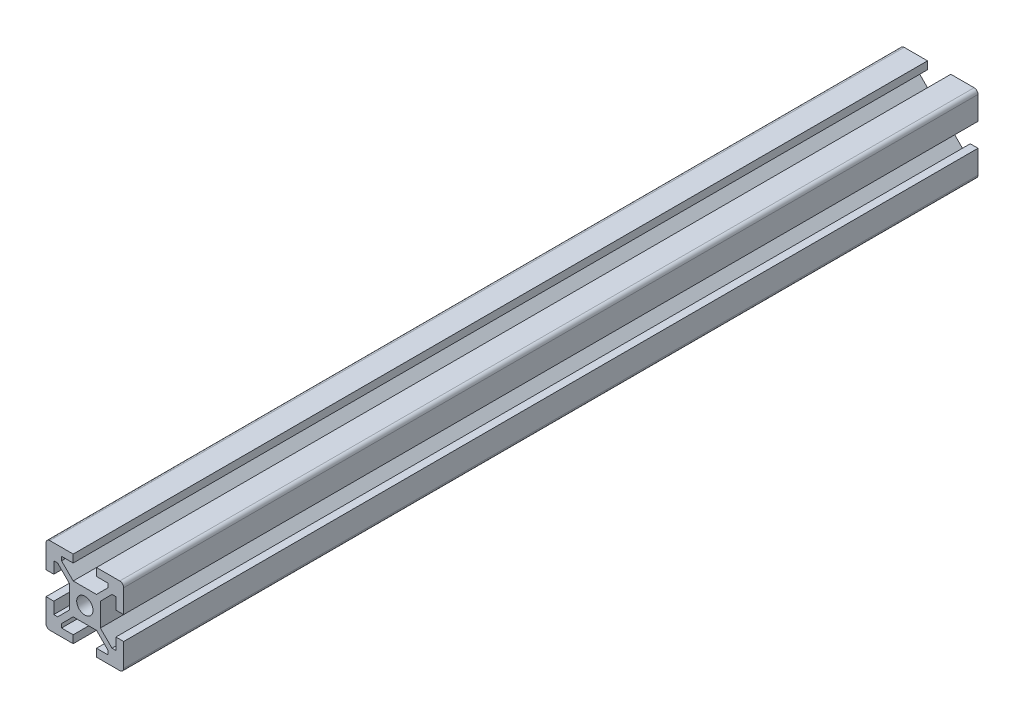
from build123d import *

# Parameters (mm, degrees)
SKETCH1_R           = 2.1
BOSS_EXTRUDE1_DEPTH = 220


with BuildPart() as part:
    # Sketch1 → Boss-Extrude1 (new body)
    with BuildSketch(Plane(origin=(0, 0, 0), x_dir=(-1, 0, 0), z_dir=(0, 0, -1))):
        with BuildLine():
            Line((6, -8), (3, -8))
            Line((3, -8), (3, -10))
            Line((3, -10), (9, -10))
            ThreePointArc((9, -10), (9.707106781, -9.707106781), (10, -9))
            Line((10, -9), (10, -3))
            Line((10, -3), (8, -3))
            Line((8, -3), (8, -6))
            Line((8, -6), (7, -6))
            Line((7, -6), (4, -3))
            Line((4, -3), (4, 3))
            Line((4, 3), (7, 6))
            Line((7, 6), (8, 6))
            Line((8, 6), (8, 3))
            Line((8, 3), (10, 3))
            Line((10, 3), (10, 9))
            ThreePointArc((10, 9), (9.707106781, 9.707106781), (9, 10))
            Line((9, 10), (3, 10))
            Line((3, 10), (3, 8))
            Line((3, 8), (6, 8))
            Line((6, 8), (6, 7))
            Line((6, 7), (3, 4))
            Line((3, 4), (-3, 4))
            Line((-3, 4), (-6, 7))
            Line((-6, 7), (-6, 8))
            Line((-6, 8), (-3, 8))
            Line((-3, 8), (-3, 10))
            Line((-3, 10), (-9, 10))
            ThreePointArc((-9, 10), (-9.707106781, 9.707106781), (-10, 9))
            Line((-10, 9), (-10, 3))
            Line((-10, 3), (-8, 3))
            Line((-8, 3), (-8, 6))
            Line((-8, 6), (-7, 6))
            Line((-7, 6), (-4, 3))
            Line((-4, 3), (-4, -3))
            Line((-4, -3), (-7, -6))
            Line((-7, -6), (-8, -6))
            Line((-8, -6), (-8, -3))
            Line((-8, -3), (-10, -3))
            Line((-10, -3), (-10, -9))
            ThreePointArc((-10, -9), (-9.707106781, -9.707106781), (-9, -10))
            Line((-9, -10), (-3, -10))
            Line((-3, -10), (-3, -8))
            Line((-3, -8), (-6, -8))
            Line((-6, -8), (-6, -7))
            Line((-6, -7), (-3, -4))
            Line((-3, -4), (3, -4))
            Line((3, -4), (6, -7))
            Line((6, -7), (6, -8))
        make_face()
        with Locations(Location((0, 0, 0), (0, 0, 180))):
            Circle(SKETCH1_R, mode=Mode.SUBTRACT)
    extrude(amount=-BOSS_EXTRUDE1_DEPTH)


solid = part.part
